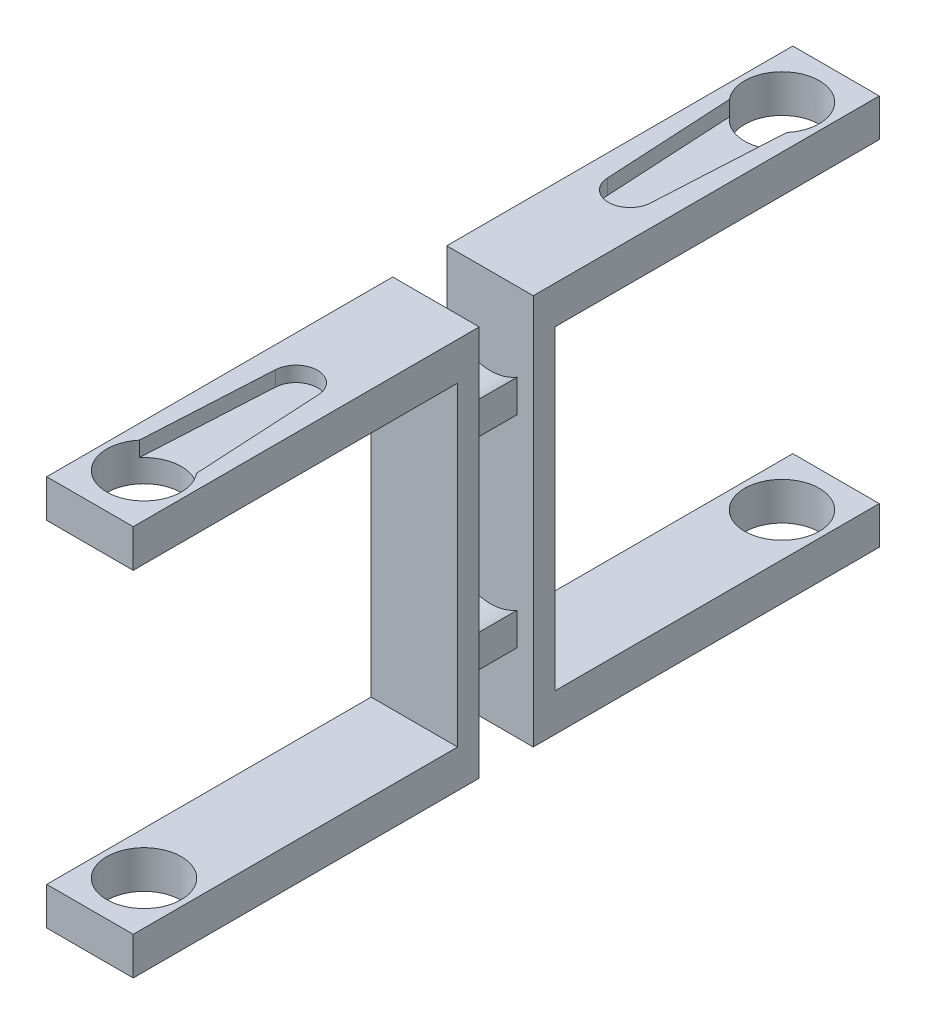
from build123d import *

# Parameters (mm, degrees)
SKETCH2_W            = 8
SKETCH2_H            = 36.15
BOSS_EXTRUDE2_DEPTH  = 2
SKETCH11_W           = 8
SKETCH11_H           = 3.5
BOSS_EXTRUDE8_DEPTH  = 30
CUT_EXTRUDE1_DEPTH   = 1.4
BOSS_EXTRUDE9_DEPTH  = 5
SKETCH15_W           = 8
SKETCH15_H           = 36.15
BOSS_EXTRUDE10_DEPTH = 2
SKETCH16_W           = 8
SKETCH16_H           = 3.5
BOSS_EXTRUDE11_DEPTH = 30
CUT_EXTRUDE4_DEPTH   = 1.4
SKETCH22_R           = 3.45
CUT_EXTRUDE6_DEPTH   = 53.440272523
SKETCH23_R           = 3.45
CUT_EXTRUDE7_DEPTH   = 53.440272523


with BuildPart() as part:
    # Sketch2 → Boss-Extrude2 (new body)
    with BuildSketch(Plane.XY):
        with Locations((-4.61160109, -17.108451256)):
            Rectangle(SKETCH2_W, SKETCH2_H)
    extrude(amount=BOSS_EXTRUDE2_DEPTH)

    # Sketch11 → Boss-Extrude8 (add)
    with BuildSketch(Plane.XY.offset(2)):
        with Locations((-4.61160109, -0.783451256)):
            Rectangle(SKETCH11_W, SKETCH11_H)
        with Locations((-4.61160109, -33.433451256)):
            Rectangle(SKETCH11_W, SKETCH11_H)
    extrude(amount=BOSS_EXTRUDE8_DEPTH)

    # Sketch12 → Cut-Extrude1 (cut)
    with BuildSketch(Plane(origin=(0, 0.966548744, 0), x_dir=(1, 0, 0), z_dir=(0, 1, 0))):
        with BuildLine():
            Line((-2.614580209, -12.840878033), (-1.96160109, -24.790927797))
            ThreePointArc((-1.96160109, -24.790927797), (-4.61160109, -30.45), (-7.26160109, -24.790927797))
            Line((-7.26160109, -24.790927797), (-6.60862197, -12.840878033))
            ThreePointArc((-6.60862197, -12.840878033), (-4.61160109, -10.95), (-2.614580209, -12.840878033))
        make_face()
    extrude(amount=-CUT_EXTRUDE1_DEPTH, mode=Mode.SUBTRACT)

    # Sketch14 → Boss-Extrude9 (add)
    with BuildSketch(Plane(origin=(0, 0, 0), x_dir=(-1, 0, 0), z_dir=(0, 0, -1))):
        with BuildLine():
            Line((2.11160109, -6.31186882), (2.11160109, -9.31186882))
            add(Edge.make_bspline(
                [(2.11160109, -9.31186882), (4.5926591, -7.783279628), (7.11160109, -9.254861144)],
                knots=[0, 0, 0, 1, 1, 1], degree=2))
            Line((7.11160109, -9.254861144), (7.11160109, -6.254861144))
            add(Edge.make_bspline(
                [(2.11160109, -6.31186882), (4.628213222, -7.783477077), (7.11160109, -6.254861144)],
                knots=[0, 0, 0, 1, 1, 1], degree=2))
        make_face()
        with BuildLine():
            Line((2.11160109, -24.982494275), (2.11160109, -27.982494275))
            add(Edge.make_bspline(
                [(2.11160109, -27.982494275), (4.610423864, -26.431016384), (7.11160109, -27.889739685)],
                knots=[0, 0, 0, 1, 1, 1], degree=2))
            Line((7.11160109, -27.889739685), (7.11160109, -24.889739685))
            add(Edge.make_bspline(
                [(2.11160109, -24.982494275), (4.664129849, -26.440271128), (7.11160109, -24.889739685)],
                knots=[0, 0, 0, 1, 1, 1], degree=2))
        make_face()
    extrude(amount=BOSS_EXTRUDE9_DEPTH)

    # Sketch15 → Boss-Extrude10 (add)
    with BuildSketch(Plane(origin=(0, 0, -5), x_dir=(-1, 0, 0), z_dir=(0, 0, -1))):
        with Locations((4.61160109, -17.108451256)):
            Rectangle(SKETCH15_W, SKETCH15_H)
    extrude(amount=BOSS_EXTRUDE10_DEPTH)

    # Sketch16 → Boss-Extrude11 (add)
    with BuildSketch(Plane(origin=(0, 0, -7), x_dir=(-1, 0, 0), z_dir=(0, 0, -1))):
        with Locations((4.61160109, -0.783451256)):
            Rectangle(SKETCH16_W, SKETCH16_H)
        with Locations((4.61160109, -33.433451256)):
            Rectangle(SKETCH16_W, SKETCH16_H)
    extrude(amount=BOSS_EXTRUDE11_DEPTH)

    # Sketch20 → Cut-Extrude4 (cut)
    with BuildSketch(Plane(origin=(0, 0.966548744, 0), x_dir=(1, 0, 0), z_dir=(0, 1, 0))):
        with BuildLine():
            Line((-6.60862197, 17.840878033), (-7.26160109, 29.790927797))
            ThreePointArc((-7.26160109, 29.790927797), (-4.61160109, 35.45), (-1.96160109, 29.790927797))
            Line((-1.96160109, 29.790927797), (-2.614580209, 17.840878033))
            ThreePointArc((-2.614580209, 17.840878033), (-4.61160109, 15.95), (-6.60862197, 17.840878033))
        make_face()
    extrude(amount=-CUT_EXTRUDE4_DEPTH, mode=Mode.SUBTRACT)

    # Sketch22 → Cut-Extrude6 (cut, through all)
    with BuildSketch(Plane(origin=(0, 0.966548744, 0), x_dir=(1, 0, 0), z_dir=(0, 1, 0))):
        with Locations(Location((-4.61160109, -27, 0), (0, 0, 270))):
            Circle(SKETCH22_R)
    extrude(amount=-CUT_EXTRUDE6_DEPTH, mode=Mode.SUBTRACT)

    # Sketch23 → Cut-Extrude7 (cut, through all)
    with BuildSketch(Plane(origin=(0, 0.966548744, 0), x_dir=(1, 0, 0), z_dir=(0, 1, 0))):
        with Locations(Location((-4.61160109, 32, 0), (0, 0, 219.814997755))):
            Circle(SKETCH23_R)
    extrude(amount=-CUT_EXTRUDE7_DEPTH, mode=Mode.SUBTRACT)


solid = part.part
